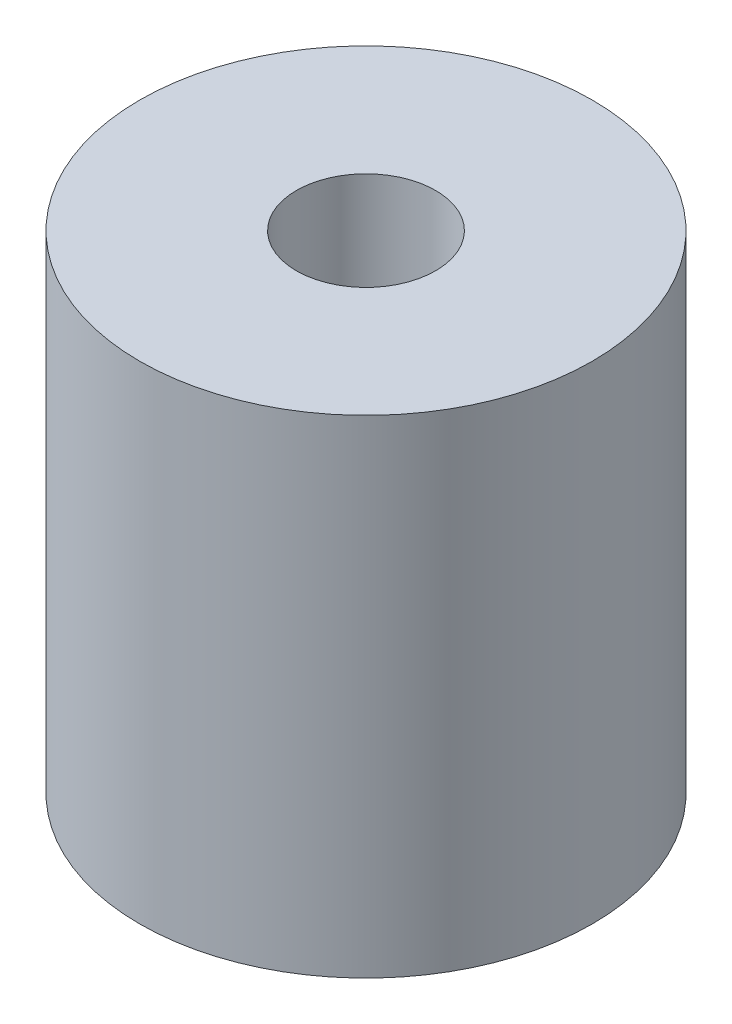
from build123d import *

# Parameters (mm, degrees)
CROQUIS1_R              = 6.5
SALIENTE_EXTRUIR1_DEPTH = 14
CORTAR_EXTRUIR1_REACH   = 18.748
CROQUIS2_R              = 2


with BuildPart() as part:
    # Croquis1 → Saliente-Extruir1 (new body)
    with BuildSketch(Plane(origin=(0, 0, 0), x_dir=(1, 0, 0), z_dir=(0, 1, 0))):
        with Locations(Location((0, 0, 0), (0, 0, 270))):
            Circle(CROQUIS1_R)
    extrude(amount=SALIENTE_EXTRUIR1_DEPTH)

    # Croquis2 → Cortar-Extruir1 (cut, up to next)
    with BuildSketch(Plane(origin=(0, 14, 0), x_dir=(1, 0, 0), z_dir=(0, 1, 0)), mode=Mode.PRIVATE) as cortar_extruir1_sk1:
        with Locations(Location((0, 0, 0), (0, 0, 270))):
            Circle(CROQUIS2_R)
    cortar_extruir1_tool1 = extrude(cortar_extruir1_sk1.sketch, amount=-CORTAR_EXTRUIR1_REACH, mode=Mode.PRIVATE) & part.part
    add(cortar_extruir1_tool1.solids().sort_by_distance((0, 14, 0))[0], mode=Mode.SUBTRACT)


solid = part.part
